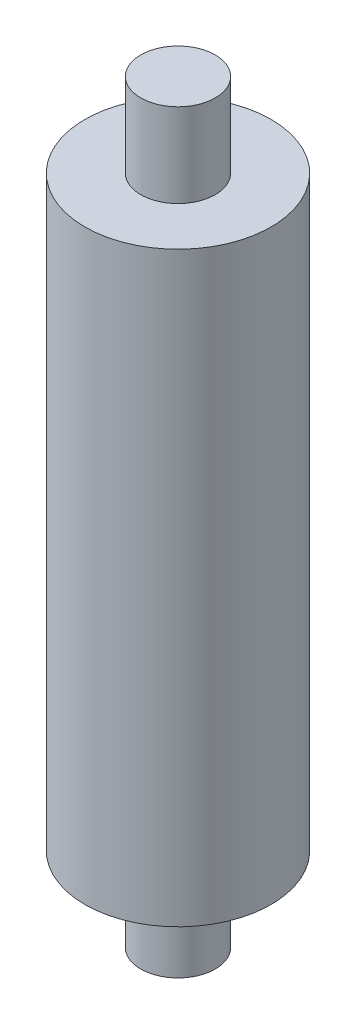
from build123d import *


with BuildPart() as part:
    # Эскиз1 → Повернуть1 (revolve)
    with BuildSketch(Plane(origin=(0, 0, 0), x_dir=(0, 0, -1), z_dir=(1, 0, 0))):
        Polygon((0, 0), (0, -40.5), (4, -40.5), (4, -31.5), (10, -31.5), (10, 0), align=None)
    revolve_1 = revolve(axis=Axis((0, -1000, 0), (0, 1, 0)))

    # Зеркальное отражение1: Повернуть1 across plane
    add(revolve_1.mirror(Plane(origin=(0, 0, -10), x_dir=(0, 0, 1), z_dir=(0, 1, 0))))


solid = part.part
